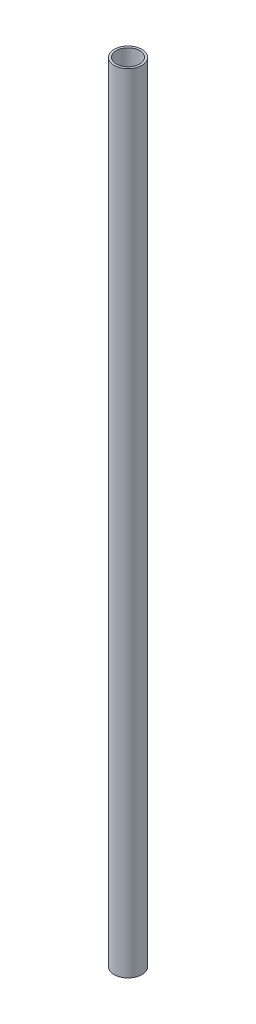
from build123d import *

# Parameters (mm, degrees)
SKETCH1_R           = 7.9375
SKETCH1_R_2         = 6.6929
BOSS_EXTRUDE1_DEPTH = 450.85


with BuildPart() as part:
    # Sketch1 → Boss-Extrude1 (new body)
    with BuildSketch(Plane(origin=(0, 0, 0), x_dir=(1, 0, 0), z_dir=(0, 1, 0))):
        Circle(SKETCH1_R)
        Circle(SKETCH1_R_2, mode=Mode.SUBTRACT)
    extrude(amount=BOSS_EXTRUDE1_DEPTH)


solid = part.part
